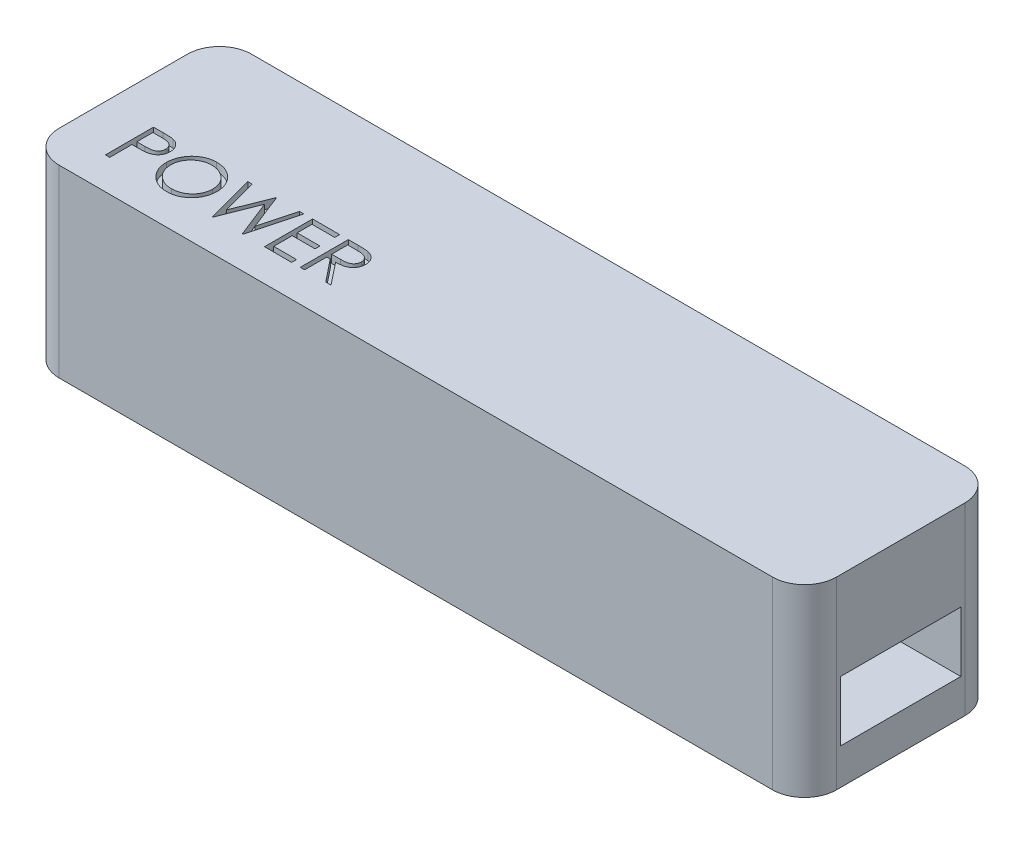
from build123d import *

# Parameters (mm, degrees)
BOSS_EXTRUDE1_DEPTH = 23
SKETCH2_W           = 15
SKETCH2_H           = 7.5
CUT_EXTRUDE1_DEPTH  = 10
CUT_EXTRUDE2_DEPTH  = 1


with BuildPart() as part:
    # Sketch1 → Boss-Extrude1 (new body)
    with BuildSketch(Plane(origin=(0, 0, 0), x_dir=(1, 0, 0), z_dir=(0, 1, 0))):
        with BuildLine():
            Line((44.5, -12), (-44.5, -12))
            ThreePointArc((-44.5, -12), (-47.328427125, -10.828427125), (-48.5, -8))
            Line((-48.5, -8), (-48.5, 8))
            ThreePointArc((-48.5, 8), (-47.328427125, 10.828427125), (-44.5, 12))
            Line((-44.5, 12), (44.5, 12))
            ThreePointArc((44.5, 12), (47.328427125, 10.828427125), (48.5, 8))
            Line((48.5, 8), (48.5, -8))
            ThreePointArc((48.5, -8), (47.328427125, -10.828427125), (44.5, -12))
        make_face()
    extrude(amount=BOSS_EXTRUDE1_DEPTH)

    # Sketch2 → Cut-Extrude1 (cut)
    with BuildSketch(Plane(origin=(48.5, 0, 0), x_dir=(0, 0, -1), z_dir=(1, 0, 0))):
        with Locations((0, 8.25)):
            Rectangle(SKETCH2_W, SKETCH2_H)
    extrude(amount=-CUT_EXTRUDE1_DEPTH, mode=Mode.SUBTRACT)

    # Sketch3 → Cut-Extrude2 (cut)
    # profile 1 of 5: a face of its own
    with BuildSketch(Plane(origin=(0, 23, 0), x_dir=(1, 0, 0), z_dir=(0, 1, 0))):
        with BuildLine():
            Line((-42.730769231, -2), (-41.554086538, -2))
            add(Edge.make_bspline(
                [(-41.554086538, -2), (-41.473153556, -2.000088965), (-41.318082369, -2.000259426), (-41.095713702, -2.005427562), (-40.893754162, -2.012330462), (-40.712639223, -2.021899422), (-40.551811627, -2.033207862), (-40.411999113, -2.049068501), (-40.292102731, -2.065629008), (-40.220263103, -2.082465705), (-40.1875, -2.090144231)],
                knots=[0, 0, 0, 0, 1.415646017, 2.712440637, 3.8905458, 4.950247383, 5.884950622, 6.709939814, 7.411656543, 8, 8, 8, 8], degree=3))
            add(Edge.make_bspline(
                [(-40.1875, -2.090144231), (-40.146025371, -2.101496145), (-40.06405341, -2.123932479), (-39.945937336, -2.168870291), (-39.833559315, -2.222154003), (-39.726533786, -2.282880757), (-39.62617593, -2.353656009), (-39.530988431, -2.431610783), (-39.441811322, -2.5185449), (-39.359146078, -2.613483311), (-39.283229283, -2.714832243), (-39.217864112, -2.824104637), (-39.163131723, -2.939461157), (-39.116188972, -3.060821565), (-39.08240305, -3.189204976), (-39.056951222, -3.32371934), (-39.040796432, -3.464350238), (-39.039249183, -3.560452868), (-39.038461538, -3.609375)],
                knots=[0, 0, 0, 0, 0.999701418, 1.975846123, 2.934577507, 3.890451536, 4.834027766, 5.787354733, 6.749476667, 7.726910423, 8.712836071, 9.690891519, 10.682875813, 11.679750201, 12.712814741, 13.765529915, 14.8625177, 16, 16, 16, 16], degree=3))
            add(Edge.make_bspline(
                [(-39.038461538, -3.609375), (-39.039183981, -3.658708332), (-39.040597488, -3.755232327), (-39.057562549, -3.896442821), (-39.080414306, -4.031388633), (-39.11555211, -4.159770548), (-39.161573264, -4.280826154), (-39.21555964, -4.396405409), (-39.280674263, -4.50454199), (-39.355493972, -4.605628477), (-39.438725276, -4.699759755), (-39.530016027, -4.786253688), (-39.628997672, -4.864603983), (-39.73535564, -4.934986286), (-39.850126809, -4.99576848), (-39.971570501, -5.050209574), (-40.100742301, -5.095931392), (-40.190129467, -5.119982926), (-40.235576923, -5.132211538)],
                knots=[0, 0, 0, 0, 1.121902311, 2.195077645, 3.232258892, 4.234102512, 5.217864754, 6.176164875, 7.132989551, 8.084763148, 9.034132444, 9.988522005, 10.94243251, 11.903244335, 12.886203696, 13.894208494, 14.929344452, 16, 16, 16, 16], degree=3))
            add(Edge.make_bspline(
                [(-40.235576923, -5.132211538), (-40.273166638, -5.14020522), (-40.355546685, -5.157723839), (-40.491219923, -5.177281193), (-40.649183442, -5.193974223), (-40.829221636, -5.206490459), (-41.031172902, -5.217205376), (-41.255146486, -5.225722109), (-41.501582047, -5.230401858), (-41.673475608, -5.230643217), (-41.763221154, -5.230769231)],
                knots=[0, 0, 0, 0, 0.601384939, 1.31797006, 2.144135048, 3.087295005, 4.142315834, 5.309527816, 6.595305764, 8, 8, 8, 8], degree=3))
            Line((-41.763221154, -5.230769231), (-42.192307692, -5.230769231))
            Line((-42.192307692, -5.230769231), (-42.192307692, -8))
            Line((-42.192307692, -8), (-42.730769231, -8))
            Line((-42.730769231, -8), (-42.730769231, -2))
        make_face()
        with BuildLine():
            Line((-42.192307692, -2.615384615), (-42.192307692, -4.615384615))
            Line((-42.192307692, -4.615384615), (-41.141826923, -4.628605769))
            add(Edge.make_bspline(
                [(-41.141826923, -4.628605769), (-41.090535622, -4.628632278), (-40.991518822, -4.628683453), (-40.848485296, -4.621851642), (-40.715783661, -4.613965014), (-40.593821532, -4.602417717), (-40.48254393, -4.586095561), (-40.381765309, -4.569618296), (-40.29226711, -4.545780532), (-40.187525621, -4.513683842), (-40.070811311, -4.458942215), (-39.94383837, -4.379485261), (-39.836231651, -4.278204047), (-39.743114571, -4.164327764), (-39.66921878, -4.037643542), (-39.615122793, -3.902096794), (-39.583337952, -3.759077623), (-39.579075906, -3.661212242), (-39.576923077, -3.611778846)],
                knots=[0, 0, 0, 0, 1.160613943, 2.240541288, 3.23993089, 4.169200891, 5.011653406, 5.7853311, 6.478053781, 7.106038997, 8.262395093, 9.384106736, 10.481365981, 11.59014053, 12.70357646, 13.786202915, 14.881775077, 16, 16, 16, 16], degree=3))
            add(Edge.make_bspline(
                [(-39.576923077, -3.611778846), (-39.579087614, -3.563541395), (-39.583390445, -3.467651311), (-39.615371925, -3.327116293), (-39.669113606, -3.192997942), (-39.743610625, -3.067901225), (-39.834023991, -2.954434703), (-39.939108579, -2.8558682), (-40.058617027, -2.776630995), (-40.169785423, -2.725488227), (-40.268530313, -2.69426204), (-40.354299387, -2.672413742), (-40.451140543, -2.654969846), (-40.559085308, -2.640844984), (-40.677297024, -2.628753336), (-40.806791278, -2.620548804), (-40.947077523, -2.615746307), (-41.044467073, -2.615508098), (-41.094951923, -2.615384615)],
                knots=[0, 0, 0, 0, 1.120700087, 2.227813068, 3.331159281, 4.466773991, 5.599788987, 6.693661531, 7.80175334, 8.91857717, 9.525282508, 10.207424825, 10.974604443, 11.810962634, 12.737642355, 13.736264703, 14.826523623, 16, 16, 16, 16], degree=3))
            Line((-41.094951923, -2.615384615), (-42.192307692, -2.615384615))
        make_face(mode=Mode.SUBTRACT)
    # profile 2 of 5: a face of its own
    with BuildSketch(Plane(origin=(0, 23, 0), x_dir=(1, 0, 0), z_dir=(0, 1, 0))):
        with BuildLine():
            add(Edge.make_bspline(
                [(-35, -1.846153846), (-34.88890039, -1.848967811), (-34.670691589, -1.854494669), (-34.349991765, -1.896801704), (-34.043828744, -1.969993801), (-33.749708506, -2.0674732), (-33.471149118, -2.197509289), (-33.206053874, -2.354683829), (-32.955053518, -2.540643473), (-32.72153115, -2.753950719), (-32.507833521, -2.98603664), (-32.319560573, -3.233713057), (-32.161773784, -3.495482432), (-32.032198149, -3.770558142), (-31.930543389, -4.058318087), (-31.860396457, -4.360296377), (-31.8155882, -4.674536418), (-31.810349724, -4.888868186), (-31.807692308, -4.997596154)],
                knots=[0, 0, 0, 0, 1.065120563, 2.091984664, 3.0946048, 4.079830382, 5.057816894, 6.036188127, 7.030412546, 8.04752943, 9.064399622, 10.05169764, 11.02544977, 11.989514704, 12.962713494, 13.945757189, 14.957906945, 16, 16, 16, 16], degree=3))
            add(Edge.make_bspline(
                [(-31.807692308, -4.997596154), (-31.810349335, -5.105523205), (-31.815586643, -5.318259925), (-31.860447405, -5.63050583), (-31.930803405, -5.930661309), (-32.031254147, -6.218225286), (-32.16021211, -6.493501109), (-32.319049546, -6.755764459), (-32.506148764, -7.005101313), (-32.719074795, -7.238780168), (-32.951190867, -7.453061546), (-33.200157039, -7.639779619), (-33.460374158, -7.800449547), (-33.735190801, -7.928650131), (-34.020962293, -8.03111628), (-34.320246275, -8.100977931), (-34.631640368, -8.146041434), (-34.84399066, -8.151216033), (-34.951923077, -8.153846154)],
                knots=[0, 0, 0, 0, 1.043624062, 2.057103931, 3.04512605, 4.022047818, 4.998200453, 5.980619268, 6.982898556, 8.009068085, 9.034988726, 10.034168286, 11.015286542, 11.987931943, 12.962482838, 13.94673481, 14.956375938, 16, 16, 16, 16], degree=3))
            add(Edge.make_bspline(
                [(-34.951923077, -8.153846154), (-35.060650481, -8.151190062), (-35.274981137, -8.145954198), (-35.589616055, -8.10107179), (-35.891806473, -8.030886698), (-36.180688218, -7.930584807), (-36.456422383, -7.800955269), (-36.719548239, -7.642890619), (-36.969009634, -7.45533552), (-37.202738342, -7.242478535), (-37.41659411, -7.010755874), (-37.603038754, -6.76246858), (-37.761138949, -6.502487797), (-37.890333233, -6.230092041), (-37.992615163, -5.946598139), (-38.062394852, -5.650115035), (-38.107542198, -5.342333025), (-38.112744792, -5.132773771), (-38.115384615, -5.026442308)],
                knots=[0, 0, 0, 0, 1.053102029, 2.075944431, 3.073151272, 4.055350789, 5.033113405, 6.020478099, 7.024410459, 8.052272461, 9.079885166, 10.07527673, 11.055994387, 12.023226415, 12.992069828, 13.970394897, 14.97016774, 16, 16, 16, 16], degree=3))
            add(Edge.make_bspline(
                [(-38.115384615, -5.026442308), (-38.114468097, -4.955072018), (-38.112646624, -4.813231806), (-38.090718008, -4.602603349), (-38.058897949, -4.395362221), (-38.01329467, -4.192097739), (-37.953651812, -3.993307479), (-37.883276908, -3.797620457), (-37.797322888, -3.607019788), (-37.700156063, -3.420602545), (-37.591707249, -3.241274707), (-37.47192025, -3.07176685), (-37.345002475, -2.910656569), (-37.205865229, -2.762118849), (-37.05909418, -2.621832581), (-36.902308389, -2.491953637), (-36.736464541, -2.371310864), (-36.560849033, -2.262590279), (-36.379789134, -2.164260334), (-36.193143229, -2.079880018), (-36.003446249, -2.007458199), (-35.80980971, -1.948759641), (-35.612747815, -1.902419008), (-35.41183047, -1.870863544), (-35.207217739, -1.848878999), (-35.069369764, -1.847066139), (-35, -1.846153846)],
                knots=[0, 0, 0, 0, 1.037015668, 2.060948919, 3.074880161, 4.083647147, 5.086022904, 6.090072063, 7.104153813, 8.122640571, 9.144368836, 10.147691507, 11.138137339, 12.123020368, 13.103399296, 14.087645067, 15.080126199, 16.082011238, 17.087798457, 18.072939717, 19.057185487, 20.037253025, 21.01195951, 21.997135196, 22.992090687, 24, 24, 24, 24], degree=3))
        make_face()
        with BuildLine():
            add(Edge.make_bspline(
                [(-34.973557692, -2.461538462), (-35.030497064, -2.462232559), (-35.143831463, -2.463614119), (-35.31231924, -2.481812488), (-35.478591126, -2.507749441), (-35.642681462, -2.544746333), (-35.803903672, -2.595153281), (-35.963760543, -2.653166267), (-36.120794349, -2.723830993), (-36.274486677, -2.803669915), (-36.423483949, -2.892039494), (-36.564077151, -2.98970538), (-36.696630255, -3.094377187), (-36.820818712, -3.206299194), (-36.936277864, -3.326041369), (-37.04528021, -3.451788402), (-37.143456635, -3.587134501), (-37.23343191, -3.728409484), (-37.313948208, -3.875429338), (-37.385545959, -4.026646244), (-37.444112831, -4.183293707), (-37.491876904, -4.343672263), (-37.53147658, -4.507527908), (-37.556563307, -4.676103649), (-37.574961638, -4.848552413), (-37.57626423, -4.965092734), (-37.576923077, -5.024038462)],
                knots=[0, 0, 0, 0, 1.008559885, 2.007477868, 2.99961109, 3.989939068, 4.984837346, 5.991145699, 7.001802488, 8.033829008, 9.059044045, 10.069351652, 11.065060232, 12.050310815, 13.029377138, 14.011219647, 14.996725999, 15.989392538, 16.977580475, 17.965360261, 18.951710183, 19.937753436, 20.929683414, 21.935841486, 22.955955122, 24, 24, 24, 24], degree=3))
            add(Edge.make_bspline(
                [(-37.576923077, -5.024038462), (-37.574737599, -5.110716554), (-37.570438089, -5.281239178), (-37.53279654, -5.531127424), (-37.474816012, -5.771278772), (-37.389346241, -6.000379188), (-37.282459473, -6.220397959), (-37.150413376, -6.429383281), (-36.993969229, -6.627391637), (-36.816260326, -6.81304067), (-36.621992829, -6.98249062), (-36.415708149, -7.131227892), (-36.199616251, -7.257074034), (-35.973153618, -7.359597016), (-35.737529265, -7.440836566), (-35.491224892, -7.496514219), (-35.235881247, -7.533157857), (-35.061828695, -7.536676867), (-34.973557692, -7.538461538)],
                knots=[0, 0, 0, 0, 1.032063989, 2.030389145, 3.003944642, 3.970395727, 4.937377036, 5.913328081, 6.909231446, 7.93887556, 8.970685674, 9.976071282, 10.964166581, 11.944589148, 12.933237628, 13.927779006, 14.949070134, 16, 16, 16, 16], degree=3))
            add(Edge.make_bspline(
                [(-34.973557692, -7.538461538), (-34.914227118, -7.537646388), (-34.79655677, -7.5360297), (-34.621535875, -7.519746254), (-34.449668083, -7.493634478), (-34.28119446, -7.456039068), (-34.116306212, -7.408986715), (-33.954315121, -7.353087752), (-33.796946624, -7.283348546), (-33.642215473, -7.206294915), (-33.49410763, -7.118454645), (-33.352721003, -7.024103531), (-33.221619324, -6.919585895), (-33.097523773, -6.809326788), (-32.981590591, -6.691103049), (-32.874603761, -6.565068383), (-32.776923535, -6.430427256), (-32.686982426, -6.289366561), (-32.606748262, -6.141944413), (-32.536841235, -5.990179251), (-32.477533608, -5.834444778), (-32.429656171, -5.67451637), (-32.392138236, -5.510697772), (-32.366286945, -5.342769638), (-32.348203907, -5.171067908), (-32.346840918, -5.054935583), (-32.346153846, -4.996394231)],
                knots=[0, 0, 0, 0, 1.047197238, 2.076906641, 3.100256066, 4.114471768, 5.12198147, 6.126382909, 7.136867548, 8.15857795, 9.17633901, 10.174870724, 11.156907918, 12.133735059, 13.104061851, 14.077631395, 15.04955518, 16.038496417, 17.029181396, 18.010275684, 18.986308667, 19.968651475, 20.955262928, 21.950658345, 22.966943676, 24, 24, 24, 24], degree=3))
            add(Edge.make_bspline(
                [(-32.346153846, -4.996394231), (-32.346841468, -4.938253366), (-32.348205494, -4.822920252), (-32.366278307, -4.652415992), (-32.392165548, -4.485696201), (-32.429473048, -4.323415395), (-32.477559025, -4.16553221), (-32.536851592, -4.012194928), (-32.606769248, -3.862832308), (-32.687011918, -3.717813513), (-32.777210473, -3.578656819), (-32.875772033, -3.445624112), (-32.984398344, -3.321213698), (-33.099985815, -3.202354223), (-33.225421619, -3.091580698), (-33.360137551, -2.988856377), (-33.502498142, -2.891702192), (-33.653230545, -2.804058372), (-33.808791609, -2.723119687), (-33.968415537, -2.65377511), (-34.130293993, -2.594851477), (-34.294015329, -2.544593823), (-34.460957577, -2.507894342), (-34.629992713, -2.481789114), (-34.80088687, -2.463620453), (-34.915818104, -2.462234661), (-34.973557692, -2.461538462)],
                knots=[0, 0, 0, 0, 1.02996197, 2.043119294, 3.035359645, 4.018872909, 4.991431989, 5.957985074, 6.929999688, 7.912076566, 8.892894881, 9.867085534, 10.843653904, 11.817741046, 12.803660682, 13.806313499, 14.818574707, 15.856120519, 16.894564902, 17.924820532, 18.937903209, 19.946497019, 20.957711757, 21.963978472, 22.977135795, 24, 24, 24, 24], degree=3))
        make_face(mode=Mode.SUBTRACT)
    # profile 3 of 5: a face of its own
    with BuildSketch(Plane(origin=(0, 23, 0), x_dir=(1, 0, 0), z_dir=(0, 1, 0))):
        Polygon((-30.961538462, -2), (-30.405048077, -2), (-29.230769231, -6.400240385), (-27.484375, -2), (-27.40625, -2), (-25.692307692, -6.370192308), (-24.512019231, -2), (-23.961538462, -2), (-25.579326923, -8), (-25.65625, -8), (-27.461538462, -3.411057692), (-29.288461538, -8), (-29.365384615, -8), align=None)
    # profile 4 of 5: a face of its own
    with BuildSketch(Plane(origin=(0, 23, 0), x_dir=(1, 0, 0), z_dir=(0, 1, 0))):
        Polygon((-22.884615385, -2), (-19.5, -2), (-19.5, -2.615384615), (-22.346153846, -2.615384615), (-22.346153846, -4.461538462), (-19.5, -4.461538462), (-19.5, -5.076923077), (-22.346153846, -5.076923077), (-22.346153846, -7.384615385), (-19.5, -7.384615385), (-19.5, -8), (-22.884615385, -8), align=None)
    # profile 5 of 5: a face of its own
    with BuildSketch(Plane(origin=(0, 23, 0), x_dir=(1, 0, 0), z_dir=(0, 1, 0))):
        with BuildLine():
            Line((-18.423076923, -2), (-17.222355769, -2))
            add(Edge.make_bspline(
                [(-17.222355769, -2), (-17.14222812, -2.000266719), (-16.988374159, -2.000778849), (-16.767962838, -2.003634442), (-16.567687814, -2.011819052), (-16.387653804, -2.018862338), (-16.22786411, -2.031705666), (-16.087828754, -2.043981061), (-15.968192702, -2.060050194), (-15.895771242, -2.074973776), (-15.862980769, -2.081730769)],
                knots=[0, 0, 0, 0, 1.410062039, 2.707475311, 3.878576406, 4.937260626, 5.877586885, 6.699081471, 7.410979367, 8, 8, 8, 8], degree=3))
            add(Edge.make_bspline(
                [(-15.862980769, -2.081730769), (-15.819083699, -2.092576653), (-15.732226003, -2.114037048), (-15.607168747, -2.159396363), (-15.488001334, -2.211887148), (-15.375218779, -2.27353924), (-15.269385994, -2.344810291), (-15.169411747, -2.42446993), (-15.074842381, -2.512082282), (-14.989502443, -2.609856296), (-14.909035498, -2.71243317), (-14.841169281, -2.823353896), (-14.782666744, -2.939345086), (-14.736088715, -3.061586374), (-14.698583617, -3.188892268), (-14.672138636, -3.32241592), (-14.656279457, -3.46154902), (-14.654664847, -3.556448292), (-14.653846154, -3.604567308)],
                knots=[0, 0, 0, 0, 1.027469482, 2.033020251, 3.019912614, 3.986113645, 4.951240523, 5.91722682, 6.890402269, 7.87763091, 8.8651537, 9.85103654, 10.82876324, 11.815024772, 12.821070561, 13.842952187, 14.906261191, 16, 16, 16, 16], degree=3))
            add(Edge.make_bspline(
                [(-14.653846154, -3.604567308), (-14.656364436, -3.684513201), (-14.661278258, -3.840508346), (-14.707092721, -4.066898429), (-14.782138184, -4.278080111), (-14.885549536, -4.47378749), (-15.017240066, -4.650205739), (-15.175511136, -4.805160806), (-15.360451042, -4.934829227), (-15.532615583, -5.024748321), (-15.684697069, -5.082336164), (-15.809897033, -5.122855637), (-15.946468995, -5.154161863), (-16.093104426, -5.182207803), (-16.250413549, -5.203382136), (-16.418019331, -5.218890584), (-16.596041305, -5.228583239), (-16.718336853, -5.230026676), (-16.78125, -5.230769231)],
                knots=[0, 0, 0, 0, 1.260483769, 2.459530307, 3.627416485, 4.787058657, 5.939039949, 7.08810263, 8.267026773, 9.491475466, 10.141966685, 10.831826277, 11.566392101, 12.351337768, 13.187381173, 14.07005841, 15.007169909, 16, 16, 16, 16], degree=3))
            Line((-16.78125, -5.230769231), (-14.576923077, -8))
            Line((-14.576923077, -8), (-15.242788462, -8))
            Line((-15.242788462, -8), (-17.447115385, -5.230769231))
            Line((-17.447115385, -5.230769231), (-17.884615385, -5.230769231))
            Line((-17.884615385, -5.230769231), (-17.884615385, -8))
            Line((-17.884615385, -8), (-18.423076923, -8))
            Line((-18.423076923, -8), (-18.423076923, -2))
        make_face()
        with BuildLine():
            Line((-17.884615385, -2.615384615), (-17.884615385, -4.615384615))
            Line((-17.884615385, -4.615384615), (-16.786057692, -4.623798077))
            add(Edge.make_bspline(
                [(-16.786057692, -4.623798077), (-16.734766197, -4.623820768), (-16.635348671, -4.623864751), (-16.491518959, -4.617018277), (-16.357598768, -4.609229732), (-16.234100336, -4.597316568), (-16.120968492, -4.581963302), (-16.018259784, -4.562758186), (-15.925806552, -4.540383222), (-15.817980486, -4.505751863), (-15.697575004, -4.450884403), (-15.566721073, -4.371057834), (-15.455288494, -4.27065363), (-15.361143587, -4.155841991), (-15.285493133, -4.029608421), (-15.232158183, -3.893466074), (-15.198313996, -3.750851906), (-15.194322204, -3.652832293), (-15.192307692, -3.603365385)],
                knots=[0, 0, 0, 0, 1.146690395, 2.22261258, 3.21895312, 4.145990853, 4.996080663, 5.770904154, 6.481378293, 7.121626537, 8.300444488, 9.431385265, 10.535395872, 11.636531494, 12.74115979, 13.810798291, 14.895190096, 16, 16, 16, 16], degree=3))
            add(Edge.make_bspline(
                [(-15.192307692, -3.603365385), (-15.194368471, -3.555114115), (-15.198452183, -3.459497706), (-15.231792929, -3.319516146), (-15.288174726, -3.187401374), (-15.364155705, -3.063690828), (-15.456725685, -2.951395281), (-15.565270507, -2.855314447), (-15.68682227, -2.776029651), (-15.800430039, -2.725364998), (-15.901974403, -2.694302393), (-15.990139534, -2.672443255), (-16.089759211, -2.654881308), (-16.20131714, -2.640810347), (-16.324337078, -2.628716157), (-16.459441051, -2.62057025), (-16.605732675, -2.615746483), (-16.707127414, -2.615508045), (-16.759615385, -2.615384615)],
                knots=[0, 0, 0, 0, 1.101028733, 2.181837193, 3.264309656, 4.369019818, 5.486613113, 6.575447106, 7.666700264, 8.788928104, 9.402425223, 10.0903467, 10.862060571, 11.710948788, 12.657782767, 13.684531032, 14.801375019, 16, 16, 16, 16], degree=3))
            Line((-16.759615385, -2.615384615), (-17.884615385, -2.615384615))
        make_face(mode=Mode.SUBTRACT)
    extrude(amount=-CUT_EXTRUDE2_DEPTH, mode=Mode.SUBTRACT)


solid = part.part
